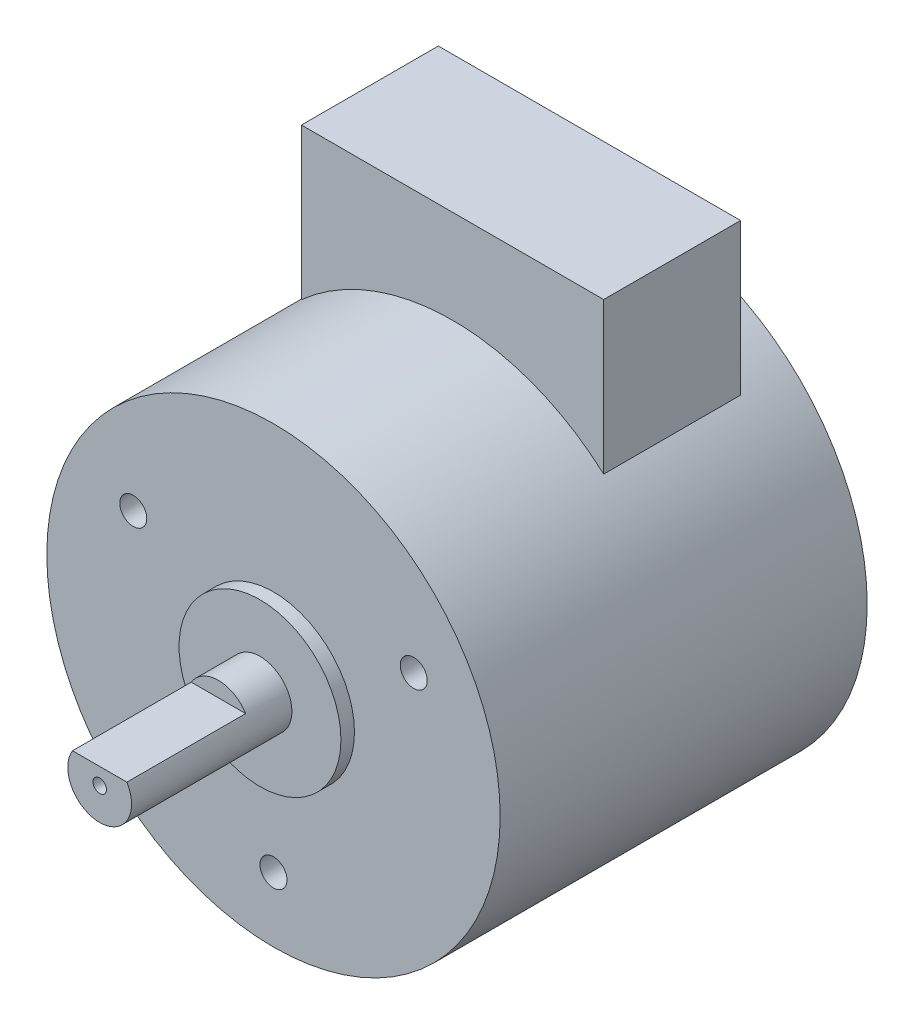
from build123d import *

# Parameters (mm, degrees)
SKETCH1_R           = 21
BOSS_EXTRUDE1_DEPTH = 34
SKETCH2_R           = 7.5
BOSS_EXTRUDE2_DEPTH = 1.25
SKETCH3_R           = 2.955
BOSS_EXTRUDE3_DEPTH = 14.85
CUT_EXTRUDE1_START  = -11
CUT_EXTRUDE1_DEPTH  = 11
SKETCH5_R           = 0.625
CUT_EXTRUDE2_DEPTH  = 20
SKETCH6_R           = 1.25
CUT_EXTRUDE3_DEPTH  = 4
CIRPATTERN1_COUNT   = 3
BOSS_EXTRUDE4_START = -29.27
BOSS_EXTRUDE4_DEPTH = 12.68
SKETCH10_R          = 4
CUT_EXTRUDE4_DEPTH  = 1.66


with BuildPart() as part:
    # Sketch1 → Boss-Extrude1 (new body)
    with BuildSketch(Plane.XY):
        Circle(SKETCH1_R)
    extrude(amount=BOSS_EXTRUDE1_DEPTH)

    # Sketch2 → Boss-Extrude2 (add)
    with BuildSketch(Plane.XY.offset(34)):
        Circle(SKETCH2_R)
    extrude(amount=BOSS_EXTRUDE2_DEPTH)

    # Sketch3 → Boss-Extrude3 (add)
    with BuildSketch(Plane.XY.offset(35.25)):
        Circle(SKETCH3_R)
    extrude(amount=BOSS_EXTRUDE3_DEPTH)

    # Sketch4 → Cut-Extrude1 (cut)
    with BuildSketch(Plane.XY.offset(50.1).offset(CUT_EXTRUDE1_START)):
        with BuildLine():
            Line((-2.518928344, 1.545), (2.518928344, 1.545))
            ThreePointArc((2.518928344, 1.545), (0, 2.955), (-2.518928344, 1.545))
        make_face()
    extrude(amount=CUT_EXTRUDE1_DEPTH, mode=Mode.SUBTRACT)

    # Sketch5 → Cut-Extrude2 (cut)
    with BuildSketch(Plane.XY.offset(50.1)):
        Circle(SKETCH5_R)
    extrude(amount=-CUT_EXTRUDE2_DEPTH, mode=Mode.SUBTRACT)

    # Sketch6 → Cut-Extrude3 (cut)
    with BuildSketch(Plane.XY.offset(34)):
        with Locations((0, -15)):
            Circle(SKETCH6_R)
    cut_extrude3 = extrude(amount=-CUT_EXTRUDE3_DEPTH, mode=Mode.SUBTRACT)

    # CirPattern1: Cut-Extrude3 ×3 about axis
    cirpattern1_axis = Axis((0, 0, 0), (0, 0, 1))
    for i in range(1, CIRPATTERN1_COUNT):
        add(cut_extrude3.rotate(cirpattern1_axis, i * 360 / CIRPATTERN1_COUNT), mode=Mode.SUBTRACT)

    # Sketch9 → Boss-Extrude4 (add)
    with BuildSketch(Plane.XY.offset(34).offset(BOSS_EXTRUDE4_START)):
        with BuildLine():
            Line((-14, 15.652475842), (-14, 29.66))
            Line((-14, 29.66), (14, 29.66))
            Line((14, 29.66), (14, 15.652475842))
            ThreePointArc((14, 15.652475842), (0, 21), (-14, 15.652475842))
        make_face()
    extrude(amount=BOSS_EXTRUDE4_DEPTH)

    # Sketch10 → Cut-Extrude4 (cut)
    with BuildSketch(Plane(origin=(0, 0, 0), x_dir=(-1, 0, 0), z_dir=(0, 0, -1))):
        Circle(SKETCH10_R)
    extrude(amount=-CUT_EXTRUDE4_DEPTH, mode=Mode.SUBTRACT)


solid = part.part
